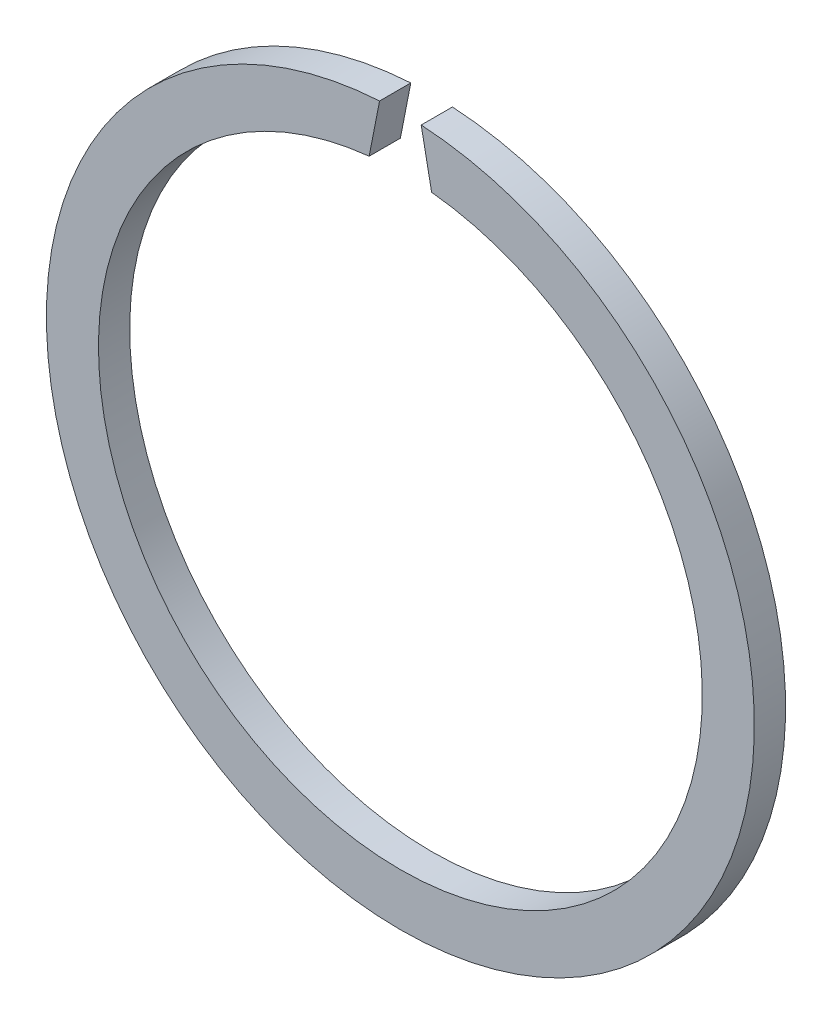
from build123d import *

# Parameters (mm, degrees)
EXTRUDE1_DEPTH = 1.5


with BuildPart() as part:
    # Sketch1 → Extrude1 (new body)
    with BuildSketch(Plane.XY):
        with BuildLine():
            Line((-1, 16.970562748), (-1.5, 14.422205102))
            ThreePointArc((-1.5, 14.422205102), (0, -14.5), (1.5, 14.422205102))
            Line((1.5, 14.422205102), (1, 16.970562748))
            ThreePointArc((1, 16.970562748), (0, -17), (-1, 16.970562748))
        make_face()
    extrude(amount=EXTRUDE1_DEPTH)


solid = part.part
